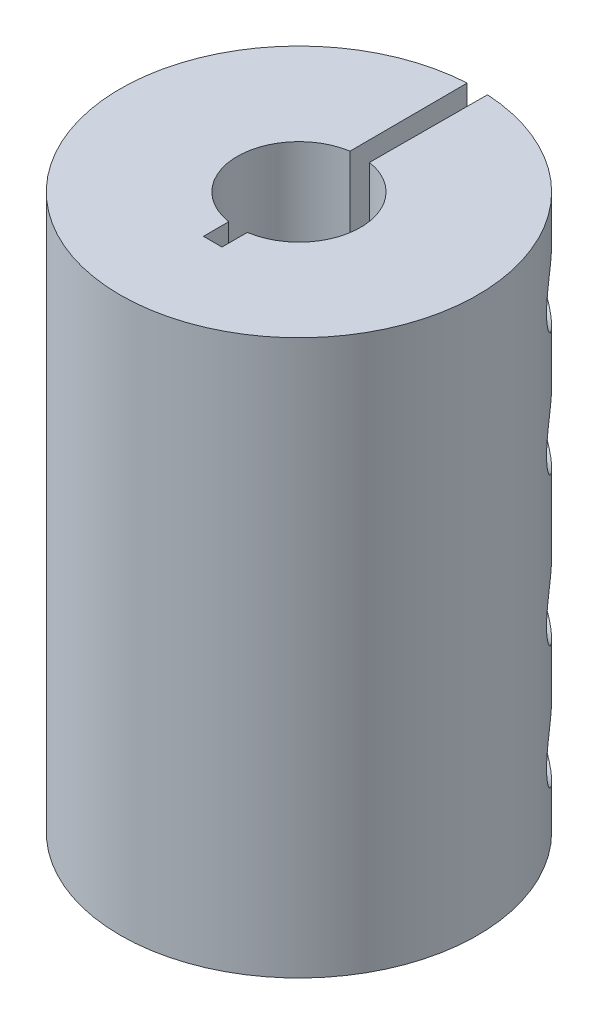
from build123d import *

# Parameters (mm, degrees)
SKETCH1_R           = 14.5
SKETCH1_R_2         = 5
BOSS_EXTRUDE1_DEPTH = 22.5
CUT_EXTRUDE1_START  = -45
CUT_EXTRUDE1_DEPTH  = 45
SKETCH3_R           = 2
CUT_EXTRUDE2_DEPTH  = 40.465174521
SKETCH4_R           = 3
CUT_EXTRUDE3_DEPTH  = 10.5


with BuildPart() as part:
    # Sketch1 → Boss-Extrude1 (new, symmetric)
    with BuildSketch(Plane(origin=(0, 0, 0), x_dir=(1, 0, 0), z_dir=(0, 1, 0))):
        with Locations(Location((0, 0, 0), (0, 0, 90))):
            Circle(SKETCH1_R)
        with Locations(Location((0, 0, 0), (0, 0, 90))):
            Circle(SKETCH1_R_2, mode=Mode.SUBTRACT)
    extrude(amount=BOSS_EXTRUDE1_DEPTH, both=True)

    # Sketch2 → Cut-Extrude1 (cut)
    with BuildSketch(Plane.XZ.offset(22.5).offset(CUT_EXTRUDE1_START)):
        with BuildLine():
            Line((-0.824967477, -14.476513001), (-0.75, 7))
            Line((-0.75, 7), (0.75, 7))
            Line((0.75, 7), (0.824967477, -14.476513001))
            ThreePointArc((0.824967477, -14.476513001), (0, -14.5), (-0.824967477, -14.476513001))
        make_face()
    extrude(amount=CUT_EXTRUDE1_DEPTH, mode=Mode.SUBTRACT)

    # Sketch3 → Cut-Extrude2 (cut, through all)
    with BuildSketch(Plane(origin=(14.5, 0, 0), x_dir=(0, 0, -1), z_dir=(1, 0, 0))):
        with Locations((11, 16)):
            Circle(SKETCH3_R)
        with Locations((11, 6)):
            Circle(SKETCH3_R)
        with Locations((11, -6)):
            Circle(SKETCH3_R)
        with Locations((11, -16)):
            Circle(SKETCH3_R)
    extrude(amount=-CUT_EXTRUDE2_DEPTH, mode=Mode.SUBTRACT)

    # Sketch4 → Cut-Extrude3 (cut)
    with BuildSketch(Plane(origin=(14.5, 0, 0), x_dir=(0, 0, -1), z_dir=(1, 0, 0))):
        with Locations((11, 16)):
            Circle(SKETCH4_R)
        with Locations((11, 6)):
            Circle(SKETCH4_R)
        with Locations((11, -6)):
            Circle(SKETCH4_R)
        with Locations((11, -16)):
            Circle(SKETCH4_R)
    extrude(amount=-CUT_EXTRUDE3_DEPTH, mode=Mode.SUBTRACT)


solid = part.part
